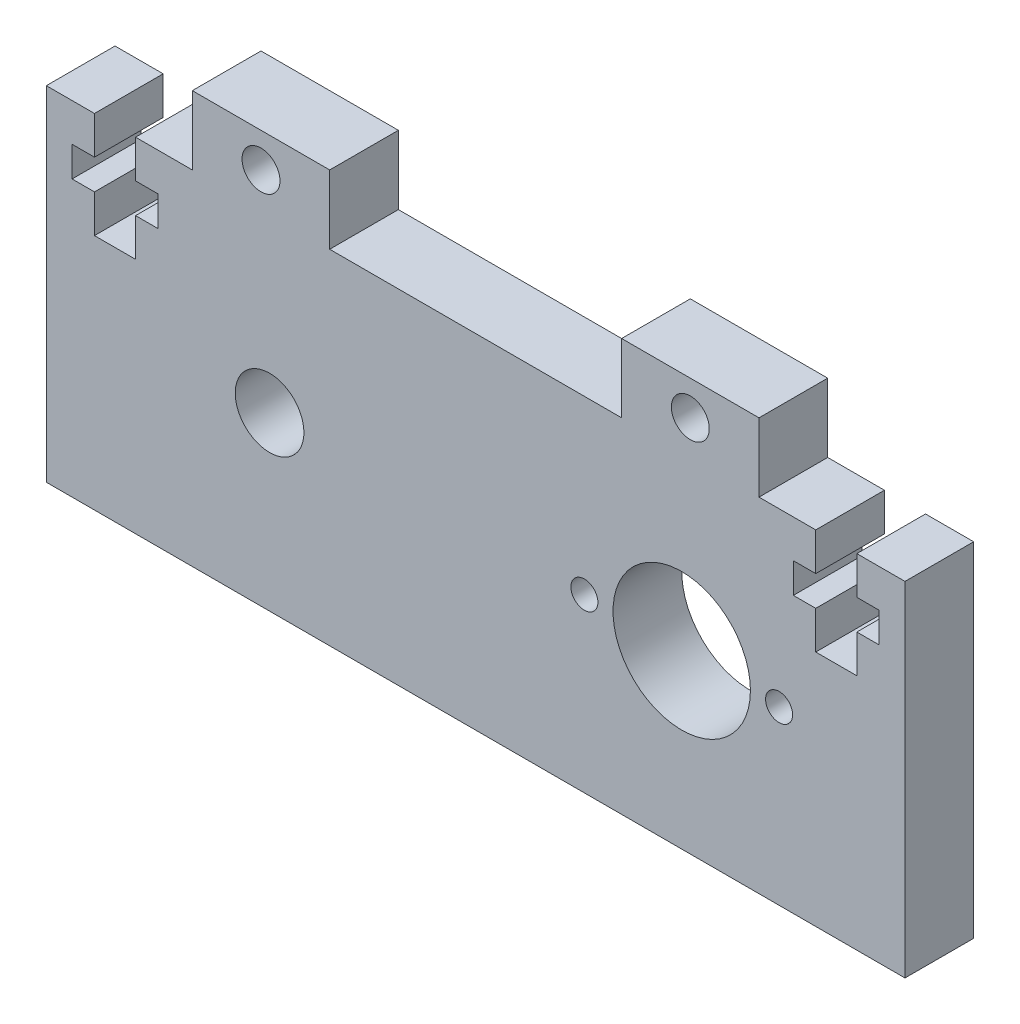
from build123d import *

# Parameters (mm, degrees)
SKETCH1_W                   = 39.6875
SKETCH1_H                   = 31.75
BOSS_EXTRUDE1_DEPTH         = 6.35
SKETCH2_R                   = 3.175
CUT_EXTRUDE1_DEPTH          = 6.35
CUT_EXTRUDE4_DEPTH          = 6.35
SKETCH4_W                   = 12.7
SKETCH4_H                   = 6.35
SKETCH4_R                   = 1.7526
BOSS_EXTRUDE2_DEPTH         = 6.35
SKETCH5_R                   = 6.35
CUT_EXTRUDE3_DEPTH          = 6.35
TAP_DRILL_FOR_M3X0_5_TAP1_D = 2.5


with BuildPart() as part:
    # Sketch1 → Boss-Extrude1 (new body)
    with BuildSketch(Plane.XY):
        with Locations((-19.84375, 0)):
            Rectangle(SKETCH1_W, SKETCH1_H)
    boss_extrude1 = extrude(amount=BOSS_EXTRUDE1_DEPTH)

    # Sketch2 → Cut-Extrude1 (cut)
    with BuildSketch(Plane.XY.offset(6.35)):
        with Locations((-19.05, 0)):
            Circle(SKETCH2_R)
    extrude(amount=-CUT_EXTRUDE1_DEPTH, mode=Mode.SUBTRACT)

    # Sketch3 → Cut-Extrude4 (cut)
    with BuildSketch(Plane.XY.offset(6.35)):
        Polygon((-35.23615, 6.096), (-31.43885, 6.096), (-31.43885, 9.5964375), (-29.36875, 9.5964375), (-29.36875, 12.3745625), (-31.43885, 12.3745625), (-31.43885, 15.875), (-35.23615, 15.875), (-35.23615, 12.3745625), (-37.30625, 12.3745625), (-37.30625, 9.5964375), (-35.23615, 9.5964375), align=None)
    cut_extrude4 = extrude(amount=-CUT_EXTRUDE4_DEPTH, mode=Mode.SUBTRACT)

    # Sketch4 → Boss-Extrude2 (add)
    with BuildSketch(Plane.XY.offset(6.35)):
        with Locations((-19.84375, 19.05)):
            Rectangle(SKETCH4_W, SKETCH4_H)
        with Locations((-19.84375, 19.05)):
            Circle(SKETCH4_R, mode=Mode.SUBTRACT)
    boss_extrude2 = extrude(amount=-BOSS_EXTRUDE2_DEPTH)

    # Mirror1: Boss-Extrude1, Cut-Extrude4, Boss-Extrude2 across plane
    add(boss_extrude1.mirror(Plane(origin=(0, -15.875, 6.35), x_dir=(0, 0, 1), z_dir=(-1, 0, 0))))
    add(cut_extrude4.mirror(Plane(origin=(0, -15.875, 6.35), x_dir=(0, 0, 1), z_dir=(-1, 0, 0))), mode=Mode.SUBTRACT)
    add(boss_extrude2.mirror(Plane(origin=(0, -15.875, 6.35), x_dir=(0, 0, 1), z_dir=(-1, 0, 0))))

    # Sketch5 → Cut-Extrude3 (cut)
    with BuildSketch(Plane.XY.offset(6.35)):
        with Locations((19.05, 0)):
            Circle(SKETCH5_R)
    extrude(amount=-CUT_EXTRUDE3_DEPTH, mode=Mode.SUBTRACT)

    # Tap Drill for M3x0.5 Tap1 (through all)
    with Locations(Plane.XY.offset(6.35)):
        with Locations((28.05, 0), (10.05, 0)):
            Hole(TAP_DRILL_FOR_M3X0_5_TAP1_D / 2)


solid = part.part
